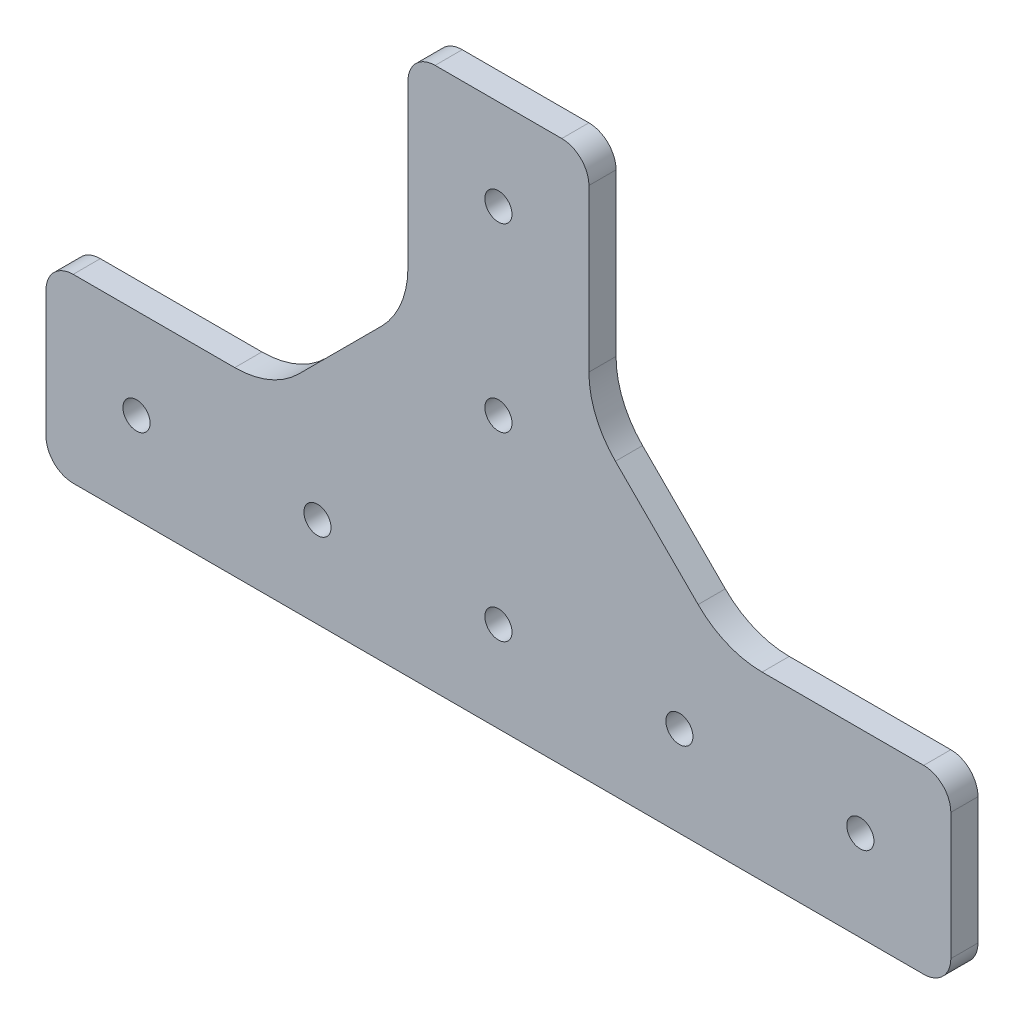
from build123d import *

# Parameters (mm, degrees)
SKETCH_1_W          = 20
SKETCH_1_H          = 60
EXTRUDE_1_DEPTH     = 3
SKETCH_2_W          = 60
SKETCH_2_H          = 20
EXTRUDE_2_DEPTH     = 3
SKETCH_3_W          = 60
SKETCH_3_H          = 20
EXTRUDE_3_DEPTH     = 3
SKETCH_4_R          = 1.5
CUT_EXTRUDE_1_DEPTH = 3
FILLET_2_R          = 3
CHAMFER_1_SIZE      = 15
FILLET_3_R          = 10


with BuildPart() as part:
    # 草图1 → 凸台-拉伸1 (new body)
    with BuildSketch(Plane.XY):
        with Locations((10, 30)):
            Rectangle(SKETCH_1_W, SKETCH_1_H)
    extrude(amount=EXTRUDE_1_DEPTH)

    # 草图2 → 凸台-拉伸2 (add)
    with BuildSketch(Plane.XY.offset(3)):
        with Locations((30, 10)):
            Rectangle(SKETCH_2_W, SKETCH_2_H)
    extrude(amount=-EXTRUDE_2_DEPTH)

    # 草图3 → 凸台-拉伸3 (add)
    with BuildSketch(Plane.XY.offset(3)):
        with Locations((-10, 10)):
            Rectangle(SKETCH_3_W, SKETCH_3_H)
    extrude(amount=-EXTRUDE_3_DEPTH)

    # 草图4 → 切除-拉伸1 (cut)
    with BuildSketch(Plane.XY.offset(3)):
        with Locations((10, 10)):
            Circle(SKETCH_4_R)
        with Locations((10, 30)):
            Circle(SKETCH_4_R)
        with Locations((10, 50)):
            Circle(SKETCH_4_R)
        with Locations((-30, 10)):
            Circle(SKETCH_4_R)
        with Locations((-10, 10)):
            Circle(SKETCH_4_R)
        with Locations((30, 10)):
            Circle(SKETCH_4_R)
        with Locations((50, 10)):
            Circle(SKETCH_4_R)
    extrude(amount=-CUT_EXTRUDE_1_DEPTH, mode=Mode.SUBTRACT)

    # 圆角2
    fillet_2_edges = [part.edges().sort_by_distance(p)[0] for p in [
        (60, 0, 1.5),
        (60, 20, 1.5),
        (-40, 20, 1.5),
        (-40, 0, 1.5),
        (0, 60, 1.5),
        (20, 60, 1.5),
    ]]
    fillet(fillet_2_edges, radius=FILLET_2_R)

    # 倒角1
    chamfer_1_edges = [part.edges().sort_by_distance(p)[0] for p in [
        (20, 20, 1.5),
        (0, 20, 1.5),
    ]]
    chamfer(chamfer_1_edges, length=CHAMFER_1_SIZE)

    # 圆角3
    fillet_3_edges = [part.edges().sort_by_distance(p)[0] for p in [
        (20, 35, 1.5),
        (35, 20, 1.5),
        (0, 35, 1.5),
        (-15, 20, 1.5),
    ]]
    fillet(fillet_3_edges, radius=FILLET_3_R)


solid = part.part
